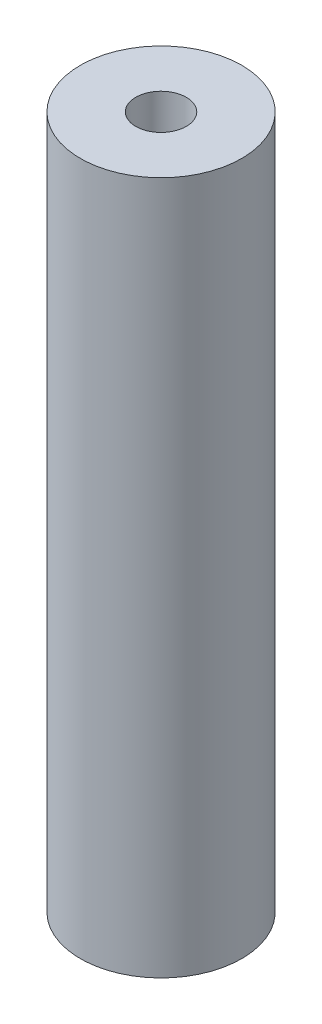
from build123d import *

# Parameters (mm, degrees)
SKETCH_1_R      = 4.725
SKETCH_1_R_2    = 1.55
EXTRUDE_1_DEPTH = 42.5
EXTRUDE_START   = -42.5
SKETCH_2_R      = 4.85
SKETCH_2_R_2    = 4.725
EXTRUDE_2_DEPTH = 42.5
SKETCH_3_R      = 4.875
SKETCH_3_R_2    = 4.85
EXTRUDE_3_DEPTH = 42.5
SKETCH_4_R      = 4.95
SKETCH_4_R_2    = 4.875
EXTRUDE_4_DEPTH = 42.5


with BuildPart() as part:
    # 草图1 → 凸台-拉伸1 (new body)
    with BuildSketch(Plane(origin=(0, 0, 0), x_dir=(1, 0, 0), z_dir=(0, 1, 0))):
        with Locations(Location((0, 0, 0), (0, 0, 270))):
            Circle(SKETCH_1_R)
        with Locations(Location((0, 0, 0), (0, 0, 270))):
            Circle(SKETCH_1_R_2, mode=Mode.SUBTRACT)
    extrude(amount=EXTRUDE_1_DEPTH)

    # 草图2 → 凸台-拉伸2 (add)
    with BuildSketch(Plane(origin=(0, 42.5, 0), x_dir=(1, 0, 0), z_dir=(0, 1, 0)).offset(EXTRUDE_START)):
        with Locations(Location((0, 0, 0), (0, 0, 270))):
            Circle(SKETCH_2_R)
        Circle(SKETCH_2_R_2, mode=Mode.SUBTRACT)
    extrude(amount=EXTRUDE_2_DEPTH)

    # 草图3 → 凸台-拉伸3 (add)
    with BuildSketch(Plane.XZ):
        with Locations(Location((0, 0, 0), (0, 0, 270))):
            Circle(SKETCH_3_R)
        Circle(SKETCH_3_R_2, mode=Mode.SUBTRACT)
    extrude(amount=-EXTRUDE_3_DEPTH)

    # 草图4 → 凸台-拉伸4 (add)
    with BuildSketch(Plane.XZ):
        with Locations(Location((0, 0, 0), (0, 0, 270))):
            Circle(SKETCH_4_R)
        Circle(SKETCH_4_R_2, mode=Mode.SUBTRACT)
    extrude(amount=-EXTRUDE_4_DEPTH)


solid = part.part
